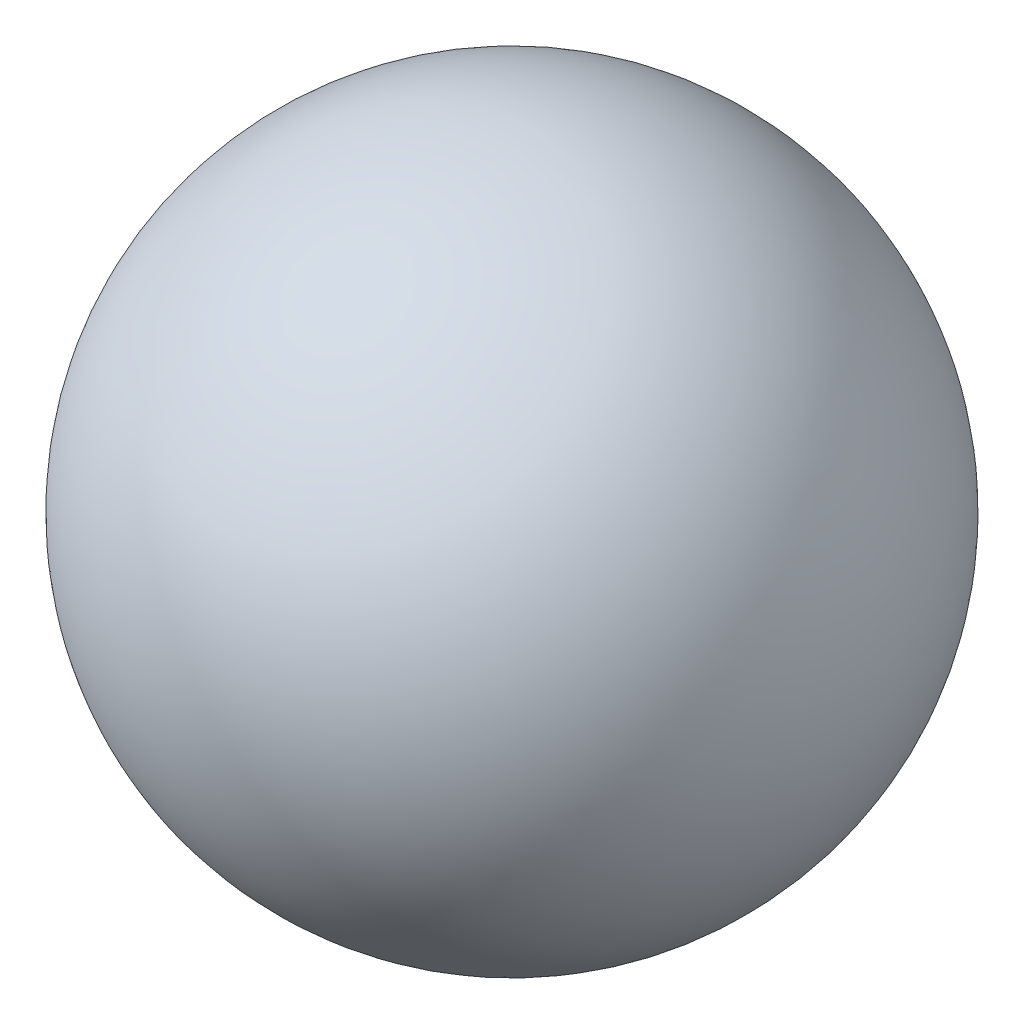
from build123d import *


with BuildPart() as part:
    # Sketch1 → Revolve1 (revolve)
    with BuildSketch(Plane.YZ):
        with BuildLine():
            Line((0, 4), (0, -4))
            ThreePointArc((0, -4), (-4, 0), (0, 4))
        make_face()
    revolve(axis=Axis((0, 0, 6.397054972), (0, 0, -1)))


solid = part.part
